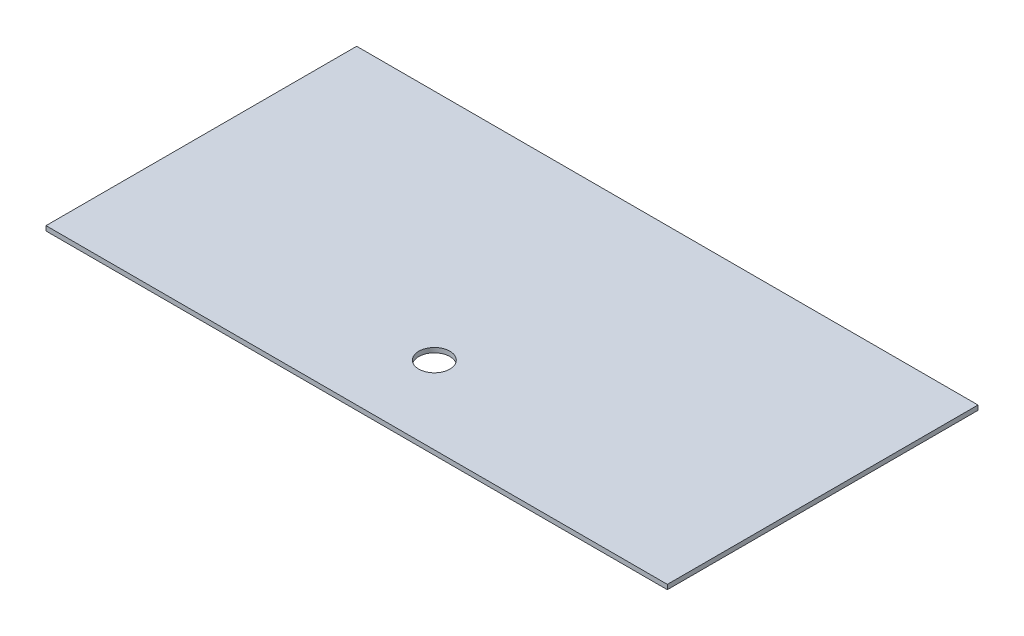
from build123d import *

# Parameters (mm, degrees)
SKETCH1_W           = 2400
SKETCH1_H           = 1200
SKETCH1_R           = 60
BOSS_EXTRUDE1_DEPTH = 18


with BuildPart() as part:
    # Sketch1 → Boss-Extrude1 (new body)
    with BuildSketch(Plane(origin=(0, 0, 0), x_dir=(1, 0, 0), z_dir=(0, 1, 0))):
        Rectangle(SKETCH1_W, SKETCH1_H)
        with Locations(Location((0, -300, 0), (0, 0, 270))):
            Circle(SKETCH1_R, mode=Mode.SUBTRACT)
    extrude(amount=BOSS_EXTRUDE1_DEPTH)


solid = part.part
